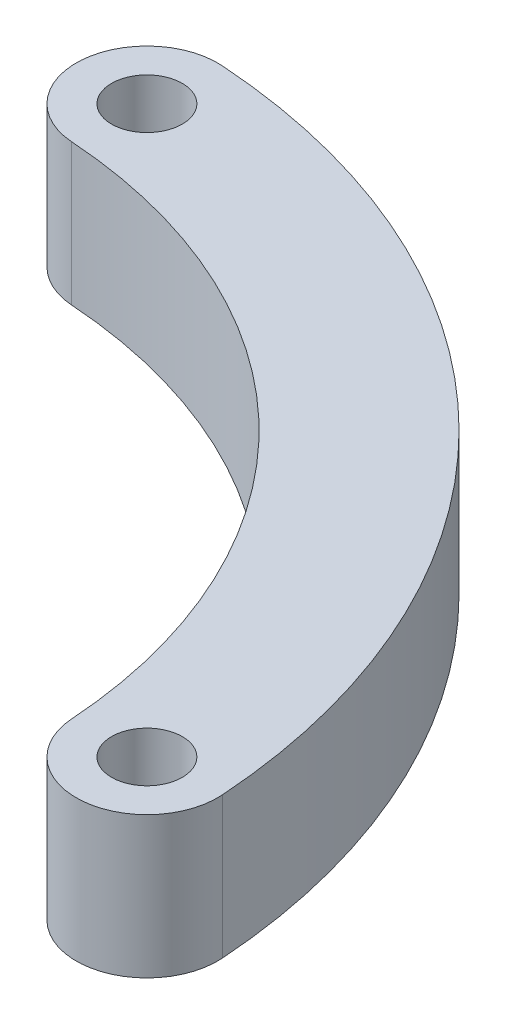
from build123d import *

# Parameters (mm, degrees)
SKETCH1_R           = 1.25
BOSS_EXTRUDE1_DEPTH = 5


with BuildPart() as part:
    # Sketch1 → Boss-Extrude1 (new body)
    with BuildSketch(Plane(origin=(0, 0, 0), x_dir=(1, 0, 0), z_dir=(0, 1, 0))):
        with BuildLine():
            ThreePointArc((-10.169419003, 7.505747166), (1.982445457, 1.982445457), (7.505747166, -10.169419003))
            ThreePointArc((7.505747166, -10.169419003), (10.169419003, -12.494252834), (12.494252834, -9.830580997))
            ThreePointArc((12.494252834, -9.830580997), (5.517979363, 5.517979363), (-9.830580997, 12.494252834))
            ThreePointArc((-9.830580997, 12.494252834), (-12.494252834, 10.169419003), (-10.169419003, 7.505747166))
        make_face()
        with Locations(Location((-10, 10, 0), (0, 0, 270))):
            Circle(SKETCH1_R, mode=Mode.SUBTRACT)
        with Locations(Location((10, -10, 0), (0, 0, 270))):
            Circle(SKETCH1_R, mode=Mode.SUBTRACT)
    extrude(amount=BOSS_EXTRUDE1_DEPTH)


solid = part.part
